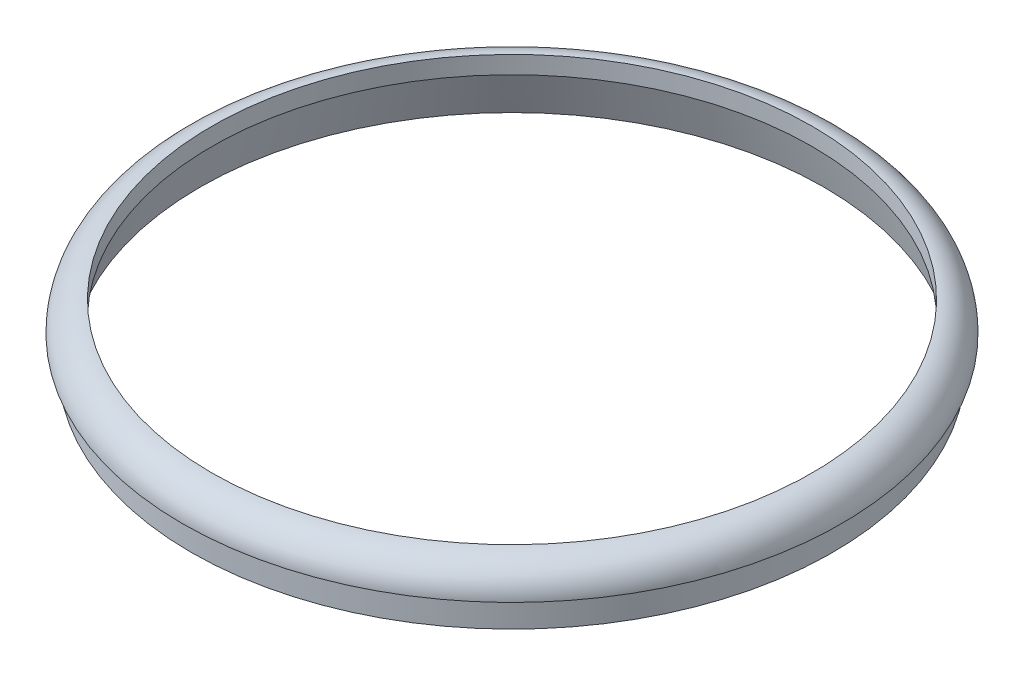
from build123d import *


with BuildPart() as part:
    # Sketch1 → Revolve1 (revolve)
    with BuildSketch(Plane.XY, mode=Mode.PRIVATE) as revolve1_sk:
        with BuildLine():
            Line((135.09625, 0), (138.90625, 0))
            Line((138.90625, 0), (138.90625, 12.7))
            Line((138.90625, 12.7), (142.71625, 12.7))
            ThreePointArc((142.71625, 12.7), (138.996506121, 21.680256121), (130.01625, 25.4))
            Line((130.01625, 25.4), (130.01625, 17.78))
            Line((130.01625, 17.78), (135.09625, 0))
        make_face()
    revolve(revolve1_sk.sketch.rotate(Axis((0, 164.38848484, 0), (0, -1, 0)), 90), axis=Axis((0, 164.38848484, 0), (0, -1, 0)))


solid = part.part
